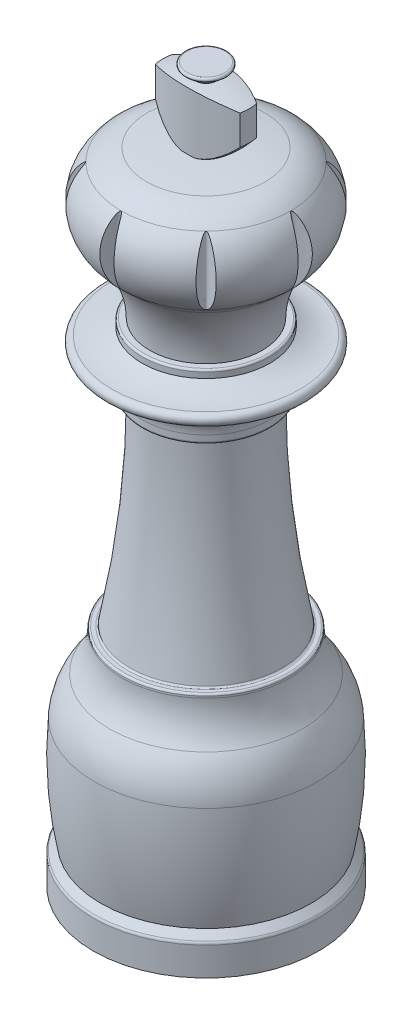
from build123d import *

# Parameters (mm, degrees)
CUT_EXTRUDE2_REACH            = 97.823
CUT_EXTRUDE2_END_MAJOR_RADIUS = 1
CUT_EXTRUDE2_END_MINOR_RADIUS = 47.5
CUT_EXTRUDE3_REACH            = 97.823
CIRPATTERN1_COUNT             = 8
SCALE1_SCALE                  = 0.766666667
SKETCH4_R                     = 10.2
CUT_EXTRUDE4_DEPTH            = 15
SKETCH9_W                     = 10.75
SKETCH9_H                     = 1


with BuildPart() as part:
    # Sketch1 → Revolve1 (revolve)
    with BuildSketch(Plane(origin=(0, 0, 0), x_dir=(0, 0, -1), z_dir=(1, 0, 0))):
        with BuildLine():
            Line((0, 95), (-2.5, 95))
            ThreePointArc((-2.5, 95), (-2.734923155, 94.835505036), (-2.660696902, 94.558488889))
            Line((-2.660696902, 94.558488889), (-1.334790711, 93.445921493))
            ThreePointArc((-1.334790711, 93.445921493), (-3.576140289, 93.107799994), (-5.75, 92.465687828))
            Line((-5.75, 92.465687828), (-5.75, 88.526819967))
            ThreePointArc((-5.75, 88.526819967), (-4.288653131, 86.96603513), (-2.637748776, 85.607322951))
            ThreePointArc((-2.637748776, 85.607322951), (-5.280067885, 85.442340866), (-7.909090909, 85.13039968))
            ThreePointArc((-7.909090909, 85.13039968), (-9.735263045, 84.56655175), (-11.305654097, 83.477193634))
            add(Edge.make_bspline(
                [(-11.305654097, 83.477193634), (-11.306548171, 83.476343481), (-11.308449321, 83.474535724), (-11.32266134, 83.46096577), (-11.344100986, 83.440320467), (-11.373732882, 83.411453676), (-11.411080339, 83.374500557), (-11.45613643, 83.329058964), (-11.508637107, 83.274880526), (-11.568308722, 83.21163566), (-11.634790911, 83.138987904), (-11.707665754, 83.056565249), (-11.864418879, 82.872343874), (-12.110093618, 82.552289845), (-12.545256174, 81.86726558), (-13.002221565, 80.816653144), (-13.225854055, 79.623406493), (-13.234343469, 78.61715561), (-13.146066684, 77.831835879), (-12.958605246, 77.057734051), (-12.664266256, 76.289021691), (-12.289671051, 75.598207181), (-11.950970362, 75.127058177), (-11.72681665, 74.858683276), (-11.620571361, 74.738548875), (-11.528058159, 74.638935799), (-11.450612647, 74.558857778), (-11.3885639, 74.496781454), (-11.34362779, 74.452898801), (-11.312351476, 74.422909272), (-11.307722305, 74.418509674), (-11.305654097, 74.416544034)],
                knots=[0, 0, 0, 0, 0.00313144, 0.00665866, 0.01085027, 0.015869374, 0.021811359, 0.028733598, 0.036672263, 0.045651261, 0.055687079, 0.066791497, 0.078973191, 0.128416372, 0.18632242, 0.31672968, 0.457733945, 0.531385888, 0.604593059, 0.683894103, 0.759896263, 0.842131054, 0.912262867, 0.930726604, 0.946895633, 0.960797586, 0.972476272, 0.982006225, 0.989526093, 0.995320499, 1, 1, 1, 1], degree=3))
            ThreePointArc((-11.305654097, 74.416544034), (-11.004132397, 74.147970654), (-10.685897436, 73.899427889))
            ThreePointArc((-10.685897436, 73.899427889), (-10.247743904, 73.520045962), (-9.878205128, 73.073559392))
            ThreePointArc((-9.878205128, 73.073559392), (-8.108524966, 69.468820326), (-7.5, 65.499486758))
            Line((-7.5, 65.499486758), (-8.25, 65.499486758))
            ThreePointArc((-8.25, 65.499486758), (-8.426776695, 65.426263453), (-8.5, 65.249486758))
            Line((-8.5, 65.249486758), (-8.5, 64.499486758))
            ThreePointArc((-8.5, 64.499486758), (-10.438447187, 63.753275507), (-12.5, 63.499486758))
            ThreePointArc((-12.5, 63.499486758), (-13.25, 62.749486758), (-12.5, 61.999486758))
            ThreePointArc((-12.5, 61.999486758), (-9.671572875, 60.827913883), (-8.5, 57.999486758))
            Line((-8.5, 57.999486758), (-8.5, 57.183986442))
            ThreePointArc((-8.5, 57.183986442), (-8.426776695, 57.007209746), (-8.25, 56.933986442))
            Line((-8.25, 56.933986442), (-7.75, 56.933986442))
            ThreePointArc((-7.75, 56.933986442), (-7.573223305, 56.860763137), (-7.5, 56.683986442))
            ThreePointArc((-7.5, 56.683986442), (-8.157370293, 43.377678032), (-10.123079163, 30.200957354))
            ThreePointArc((-10.123079163, 30.200957354), (-10.20972975, 30.056660064), (-10.368221609, 30))
            Line((-10.368221609, 30), (-10.868221609, 30))
            ThreePointArc((-10.868221609, 30), (-11.044998304, 29.926776695), (-11.118221609, 29.75))
            Line((-11.118221609, 29.75), (-11.118221609, 29.5))
            ThreePointArc((-11.118221609, 29.5), (-11.563039127, 26.869559416), (-12.848026026, 24.531635345))
            ThreePointArc((-12.848026026, 24.531635345), (-14.226886449, 22.132425629), (-14.843478261, 19.434782609))
            ThreePointArc((-14.843478261, 19.434782609), (-14.908268747, 12.188961562), (-14, 5))
            Line((-14, 5), (-14.853553391, 4.146446609))
            ThreePointArc((-14.853553391, 4.146446609), (-14.961939766, 3.984234935), (-15, 3.792893219))
            Line((-15, 3.792893219), (-15, 0))
            Line((-15, 0), (0, 0))
            Line((0, 0), (0, 95))
        make_face()
    revolve(axis=Axis((0, 0, 0), (0, -1, 0)))

    # Cut-Extrude2: up to this torus (the profile starts outside it)
    cut_extrude2_end = Plane(origin=(0, 38.135565253, 0), z_dir=(0, 1, 0)) * Torus(CUT_EXTRUDE2_END_MAJOR_RADIUS, CUT_EXTRUDE2_END_MINOR_RADIUS, mode=Mode.PRIVATE)
    # Sketch3 → Cut-Extrude2 (cut, up to the surface)
    with BuildSketch(Plane(origin=(0, 93.445921493, 0), x_dir=(1, 0, 0), z_dir=(0, 1, 0)), mode=Mode.PRIVATE) as cut_extrude2_sk1:
        with BuildLine():
            ThreePointArc((-5.643115564, 1.103515625), (0, 2.5), (5.643115564, 1.103515625))
            ThreePointArc((5.643115564, 1.103515625), (0, 5.75), (-5.643115564, 1.103515625))
        make_face()
    cut_extrude2_tool1 = extrude(cut_extrude2_sk1.sketch, amount=-CUT_EXTRUDE2_REACH, mode=Mode.PRIVATE) - cut_extrude2_end
    add(cut_extrude2_tool1.solids().sort_by_distance((0, 93.445921, -3.558898))[0], mode=Mode.SUBTRACT)
    # Sketch3 → Cut-Extrude2 (cut, up to the surface)
    with BuildSketch(Plane(origin=(0, 93.445921493, 0), x_dir=(1, 0, 0), z_dir=(0, 1, 0)), mode=Mode.PRIVATE) as cut_extrude2_sk2:
        with BuildLine():
            ThreePointArc((5.643115564, -1.103515625), (0, -2.5), (-5.643115564, -1.103515625))
            ThreePointArc((-5.643115564, -1.103515625), (0, -5.75), (5.643115564, -1.103515625))
        make_face()
    cut_extrude2_tool2 = extrude(cut_extrude2_sk2.sketch, amount=-CUT_EXTRUDE2_REACH, mode=Mode.PRIVATE) - cut_extrude2_end
    add(cut_extrude2_tool2.solids().sort_by_distance((0, 93.445921, 3.558898))[0], mode=Mode.SUBTRACT)

    # Cut-Extrude3: up to this face of the body (flat: up to its plane)
    cut_extrude3_end = Plane(part.part.faces().sort_by_distance((0, 65.499486758, -7.733345238))[0])
    # Sketch3<3> → Cut-Extrude3 (cut, up to the picked face)
    with BuildSketch(Plane(origin=(0, 93.445921493, 0), x_dir=(1, 0, 0), z_dir=(0, 1, 0)), mode=Mode.PRIVATE) as cut_extrude3_sk1:
        with BuildLine():
            ThreePointArc((13.19433156, -0.935297507), (13.227435766, 0.010479048), (13.192833075, 0.956201964))
            add(Edge.make_bspline(
                [(13.192833075, 0.956201964), (10.662902661, 0.008119881), (13.19433156, -0.935297507)],
                knots=[0.004254899, 0.004254899, 0.004254899, 0.446534844, 0.446534844, 0.446534844], degree=2, weights=[1.037398157, 2.962572799, 1.037456245]))
        make_face()
    cut_extrude3_tool1 = split(extrude(cut_extrude3_sk1.sketch, amount=-CUT_EXTRUDE3_REACH, mode=Mode.PRIVATE), bisect_by=cut_extrude3_end, keep=Keep.BOTH, mode=Mode.PRIVATE)
    cut_extrude3 = cut_extrude3_tool1.solids().sort_by(Axis((12.497616, 93.445921, -0.009812), (0, -1, 0)))[0]
    add(cut_extrude3, mode=Mode.SUBTRACT)

    # CirPattern1: Cut-Extrude3 ×8 about axis
    cirpattern1_axis = Axis((0, 0, 0), (0, -1, 0))
    for i in range(1, CIRPATTERN1_COUNT):
        add(cut_extrude3.rotate(cirpattern1_axis, i * 360 / CIRPATTERN1_COUNT), mode=Mode.SUBTRACT)


with BuildPart() as part_1:
    # Scale1: scaled about (0, 0, 0)
    add(part.part.scale(SCALE1_SCALE))

    # Sketch4 → Cut-Extrude4 (cut)
    with BuildSketch(Plane.XZ):
        with Locations(Location((0, 0, 0), (0, 0, 270))):
            Circle(SKETCH4_R)
    extrude(amount=-CUT_EXTRUDE4_DEPTH, mode=Mode.SUBTRACT)

    # Sketch9 → Cut-Revolve1 (revolve, cut)
    with BuildSketch(Plane.XY, mode=Mode.PRIVATE) as cut_revolve1_sk:
        with Locations((-5.375, 0.5)):
            Rectangle(SKETCH9_W, SKETCH9_H)
    revolve(cut_revolve1_sk.sketch.rotate(Axis((0, 0, 0), (0, -1, 0)), 270), axis=Axis((0, 0, 0), (0, -1, 0)), mode=Mode.SUBTRACT)


with BuildPart() as body_2:
    # Sketch10 → Base (Black King) (revolve)
    with BuildSketch(Plane.XY, mode=Mode.PRIVATE) as base_black_king_sk:
        Polygon((0, 0), (0, 7.5), (-10, 7.5), (-10, 1), (-10.55, 1), (-10.55, 0), align=None)
    revolve(base_black_king_sk.sketch.rotate(Axis((0, 0, 0), (0, -1, 0)), 270), axis=Axis((0, 0, 0), (0, -1, 0)))


solid = Compound([part_1.part, body_2.part])
